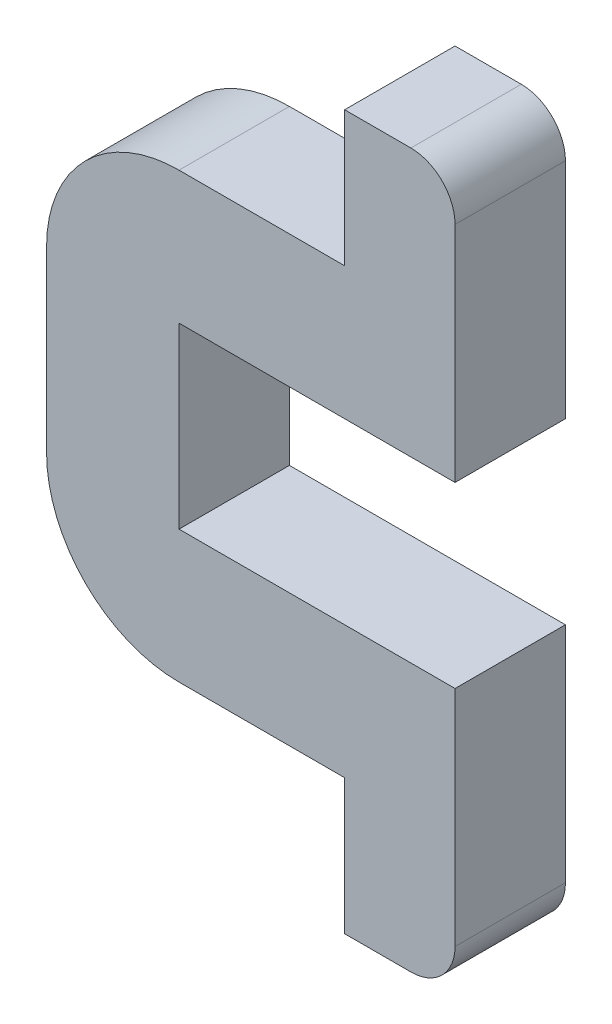
from build123d import *

# Parameters (mm, degrees)
BOSS_EXTRUDE1_DEPTH = 0.125
FILLET1_R           = 0.3
FILLET2_R           = 0.1


with BuildPart() as part:
    # frame_outline → Boss-Extrude1 (new, symmetric)
    with BuildSketch(Plane.XY):
        Polygon((0, 0), (-0.625, 0), (-0.625, 0.404), (0, 0.404), (0, 1.01), (-0.25, 1.01), (-0.25, 0.704), (-0.925, 0.704), (-0.925, -0.3), (-0.25, -0.3), (-0.25, -0.606), (0, -0.606), align=None)
    extrude(amount=BOSS_EXTRUDE1_DEPTH, both=True)

    # Fillet1
    fillet1_edges = [part.edges().sort_by_distance(p)[0] for p in [
        (-0.925, -0.3, 0),
        (-0.925, 0.704, 0),
    ]]
    fillet(fillet1_edges, radius=FILLET1_R)

    # Fillet2
    fillet2_edges = [part.edges().sort_by_distance(p)[0] for p in [
        (0, -0.606, 0),
        (0, 1.01, 0),
    ]]
    fillet(fillet2_edges, radius=FILLET2_R)


solid = part.part
